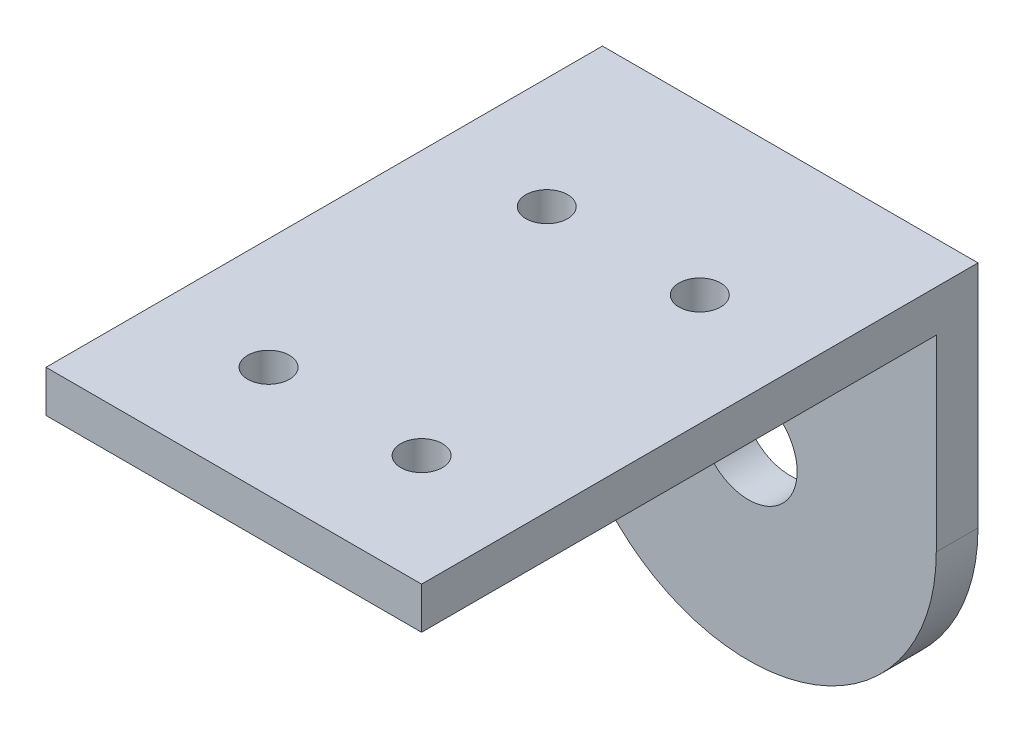
from build123d import *

# Parameters (mm, degrees)
MODEL_R             = 3.5
EXTRUDE_1_DEPTH     = 40
SKETCH_3_W          = 37
SKETCH_3_H          = 37
CUT_EXTRUDE_1_DEPTH = 40
SKETCH_4_R          = 1.5
CUT_EXTRUDE_2_DEPTH = 40


with BuildPart() as part:
    # Model → 凸台-拉伸1 (new body)
    with BuildSketch(Plane.XY):
        with BuildLine():
            Line((2619.766714505, 1592.826425633), (2619.766714505, 1609.326425633))
            Line((2619.766714505, 1609.326425633), (2592.766714505, 1609.326425633))
            Line((2592.766714505, 1609.326425633), (2592.766714505, 1592.826425633))
            ThreePointArc((2592.766714505, 1592.826425633), (2606.266714505, 1579.326425633), (2619.766714505, 1592.826425633))
        make_face()
        with Locations((2606.266714505, 1592.826425633)):
            Circle(MODEL_R, mode=Mode.SUBTRACT)
    extrude(amount=EXTRUDE_1_DEPTH)

    # 草图3 → 切除-拉伸1 (cut)
    with BuildSketch(Plane(origin=(2619.766714505, 0, 0), x_dir=(0, 0, -1), z_dir=(1, 0, 0))):
        with Locations((-21.5, 1587.826425633)):
            Rectangle(SKETCH_3_W, SKETCH_3_H)
    extrude(amount=-CUT_EXTRUDE_1_DEPTH, mode=Mode.SUBTRACT)

    # 草图4 → 切除-拉伸2 (cut)
    with BuildSketch(Plane(origin=(0, 1609.326425633, 0), x_dir=(1, 0, 0), z_dir=(0, 1, 0))):
        with Locations(Location((2600.766714505, -32, 0), (0, 0, 270))):
            Circle(SKETCH_4_R)
        with Locations(Location((2611.766714505, -32, 0), (0, 0, 270))):
            Circle(SKETCH_4_R)
        with Locations(Location((2600.766714505, -12, 0), (0, 0, 270))):
            Circle(SKETCH_4_R)
        with Locations(Location((2611.766714505, -12, 0), (0, 0, 270))):
            Circle(SKETCH_4_R)
    extrude(amount=-CUT_EXTRUDE_2_DEPTH, mode=Mode.SUBTRACT)


solid = part.part
